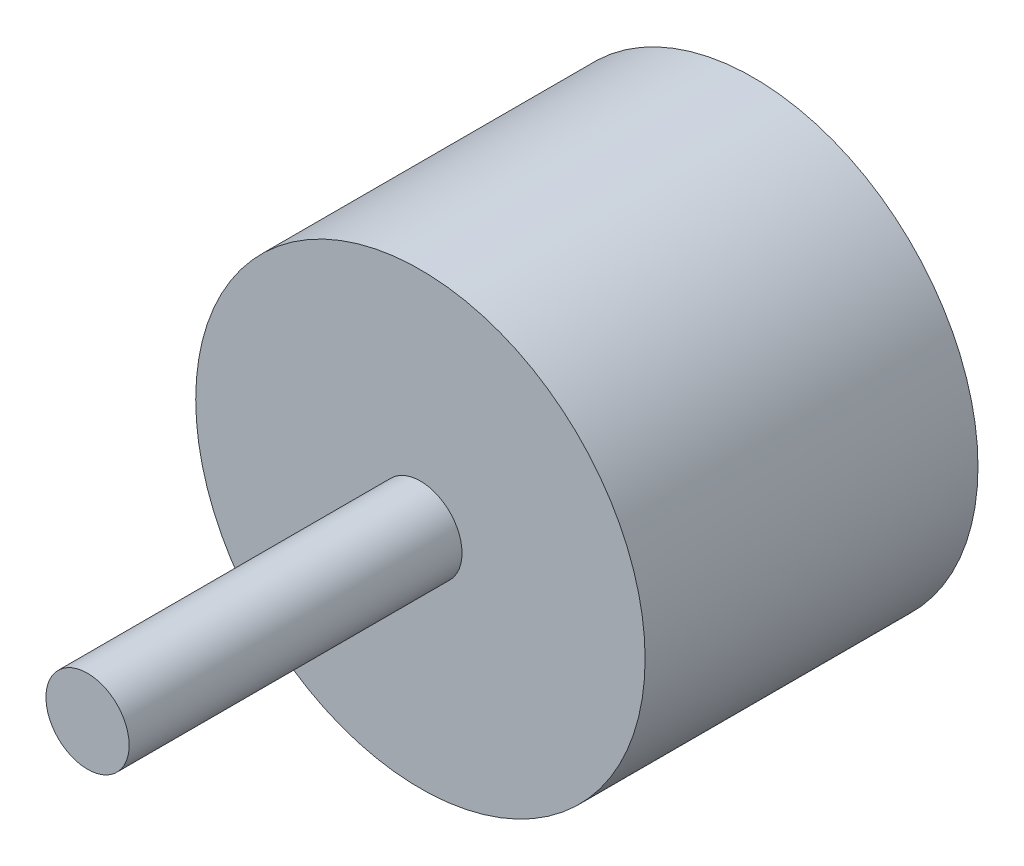
from build123d import *

# Parameters (mm, degrees)
SKETCH1_R           = 27
BOSS_EXTRUDE1_DEPTH = 40
SKETCH2_R           = 5
BOSS_EXTRUDE2_DEPTH = 40


with BuildPart() as part:
    # Sketch1 → Boss-Extrude1 (new body)
    with BuildSketch(Plane.XY):
        Circle(SKETCH1_R)
    extrude(amount=BOSS_EXTRUDE1_DEPTH)

    # Sketch2 → Boss-Extrude2 (add)
    with BuildSketch(Plane.XY.offset(40)):
        Circle(SKETCH2_R)
    extrude(amount=BOSS_EXTRUDE2_DEPTH)


solid = part.part
